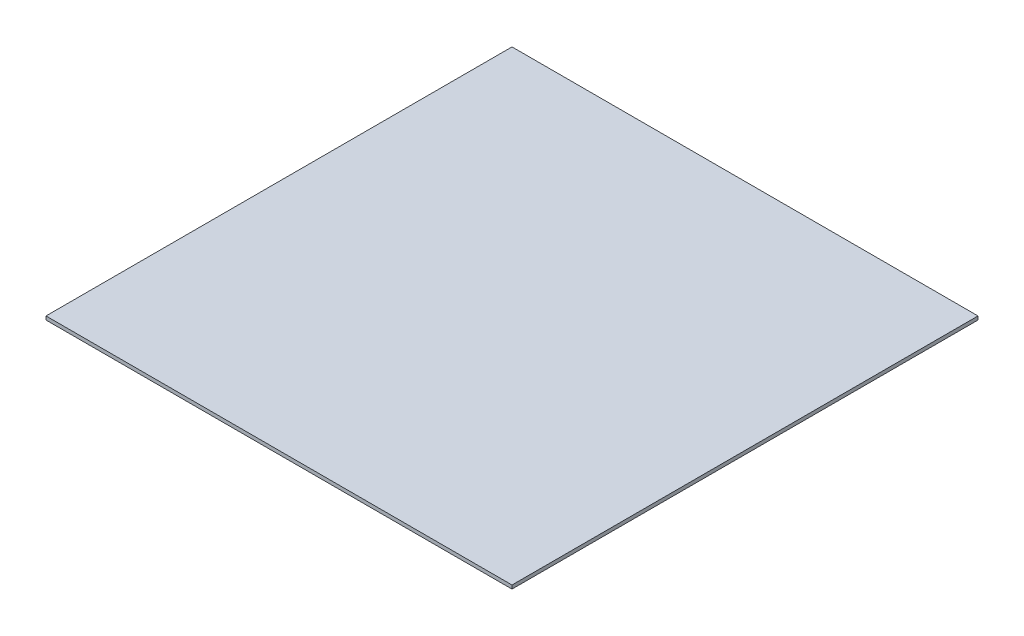
from build123d import *

# Parameters (mm, degrees)
SKETCH_1_W        = 260
SKETCH_1_H        = 260
EXTRUDE_278_DEPTH = 2


with BuildPart() as part:
    # 草图1 → Extrude 278 (new body)
    with BuildSketch(Plane(origin=(0, 0, 0), x_dir=(1, 0, 0), z_dir=(0, 1, 0))):
        Rectangle(SKETCH_1_W, SKETCH_1_H)
    extrude(amount=EXTRUDE_278_DEPTH)


solid = part.part
